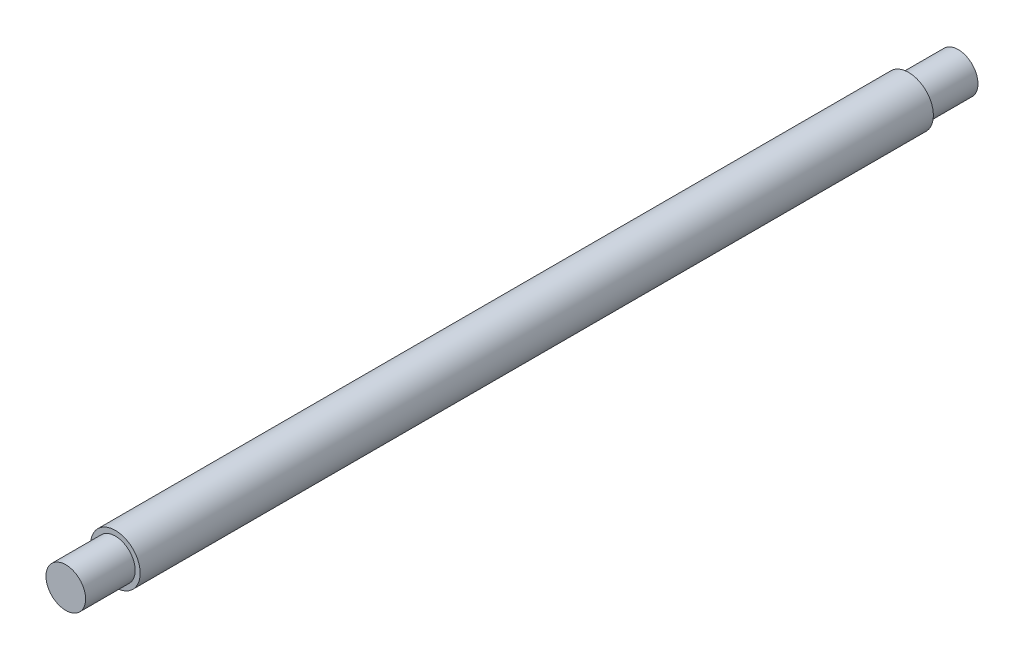
from build123d import *

# Parameters (mm, degrees)
SKETCH_1_R      = 2.5
EXTRUDE_1_DEPTH = 80
SKETCH_2_R      = 2
EXTRUDE_2_DEPTH = 5
EXTRUDE_START   = 5
SKETCH_3_R      = 2
EXTRUDE_3_DEPTH = 5


with BuildPart() as part:
    # 草图1 → 凸台-拉伸1 (new body)
    with BuildSketch(Plane.XY):
        with Locations((-0.6401844, 5.281521297)):
            Circle(SKETCH_1_R)
    extrude(amount=EXTRUDE_1_DEPTH)

    # 草图2 → 凸台-拉伸2 (add)
    with BuildSketch(Plane.XY.offset(80)):
        with Locations((-0.6401844, 5.281521297)):
            Circle(SKETCH_2_R)
    extrude(amount=EXTRUDE_2_DEPTH)

    # 草图3 → 凸台-拉伸3 (add)
    with BuildSketch(Plane(origin=(0, 0, 0), x_dir=(-1, 0, 0), z_dir=(0, 0, -1)).offset(EXTRUDE_START)):
        with Locations(Location((0.6401844, 5.281521297, 0), (0, 0, 180))):
            Circle(SKETCH_3_R)
    extrude(amount=-EXTRUDE_3_DEPTH)


solid = part.part
